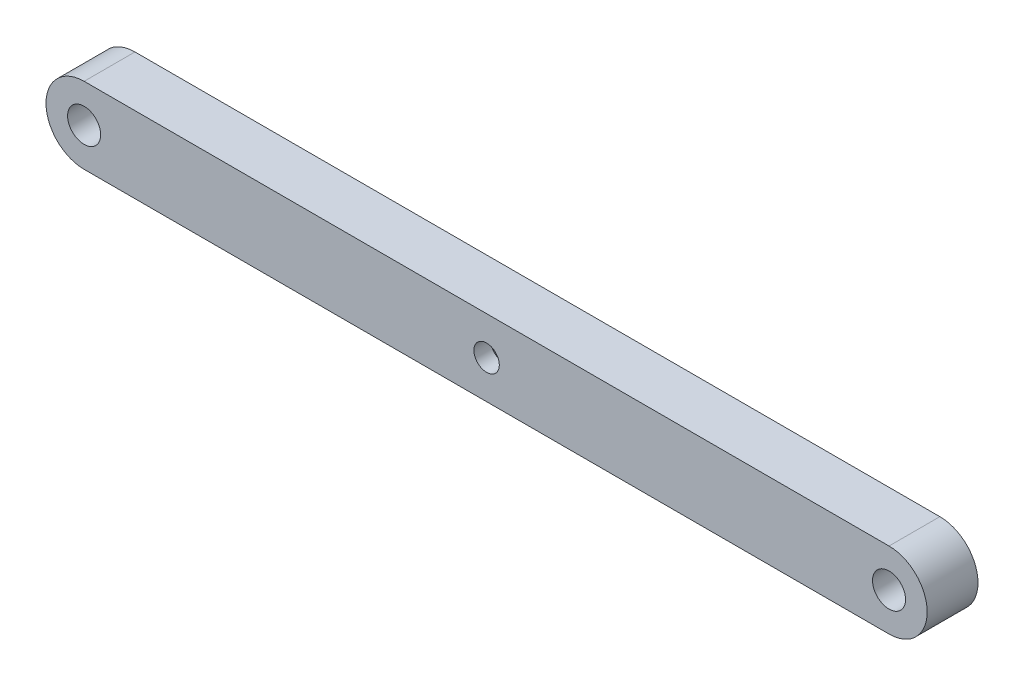
from build123d import *

# Parameters (mm, degrees)
BOSS_EXTRUDE1_DEPTH        = 6
F_3_9_3_9_DIAMETER_HOLE1_D = 3.9


with BuildPart() as part:
    # Sketch1 → Boss-Extrude1 (new body)
    with BuildSketch(Plane.XY.offset(6)):
        with BuildLine():
            Line((47.5, 4.5), (-47.5, 4.5))
            ThreePointArc((-47.5, 4.5), (-52, 0), (-47.5, -4.5))
            Line((-47.5, -4.5), (47.5, -4.5))
            ThreePointArc((47.5, -4.5), (52, 0), (47.5, 4.5))
        make_face()
    extrude(amount=-BOSS_EXTRUDE1_DEPTH)

    # Ø3.9 (3.9) Diameter Hole1 (through all)
    with Locations(Plane(origin=(0, 0, 0), x_dir=(-1, 0, 0), z_dir=(0, 0, -1))):
        with Locations((47.5, 0), (-47.5, 0)):
            Hole(F_3_9_3_9_DIAMETER_HOLE1_D / 2)

    # Sketch4 → CSK for M2.5 Flat Head Machine Screw1 (revolve, cut)
    with BuildSketch(Plane.YZ):
        Polygon((0, 0), (0, 6), (1.5, 6), (1.5, 4), (2.5, 3), (2.5, 0), align=None)
    revolve(axis=Axis((0, 0, -6.35), (0, 0, 1)), mode=Mode.SUBTRACT)


solid = part.part
